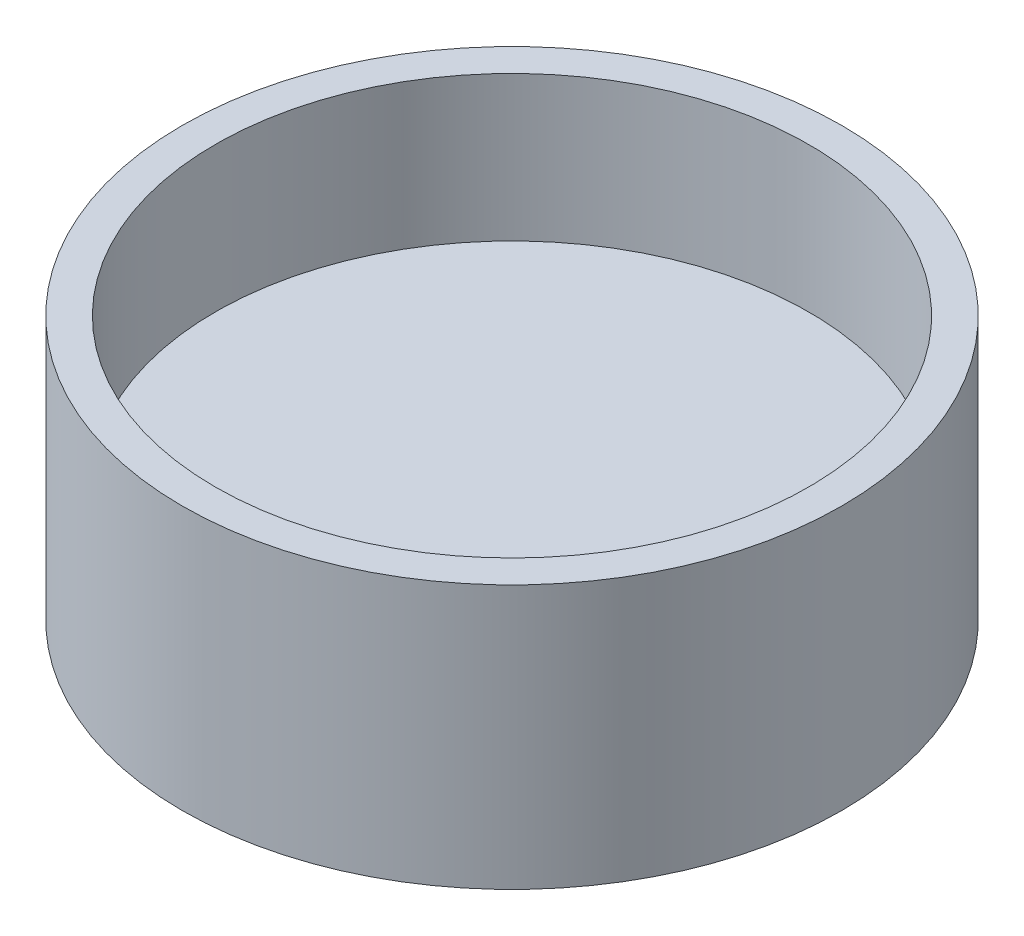
from build123d import *

# Parameters (mm, degrees)
SKETCH1_R           = 12.5
BOSS_EXTRUDE1_DEPTH = 5
SKETCH2_R           = 11.25
CUT_EXTRUDE1_DEPTH  = 5.5
CUT_EXTRUDE2_START  = -3
SKETCH3_R           = 11.25
CUT_EXTRUDE2_DEPTH  = 3


with BuildPart() as part:
    # Sketch1 → Boss-Extrude1 (new, symmetric)
    with BuildSketch(Plane(origin=(0, 0, 0), x_dir=(1, 0, 0), z_dir=(0, 1, 0))):
        with Locations(Location((0, 0, 0), (0, 0, 270))):
            Circle(SKETCH1_R)
    extrude(amount=BOSS_EXTRUDE1_DEPTH, both=True)

    # Sketch2 → Cut-Extrude1 (cut)
    with BuildSketch(Plane(origin=(0, 5, 0), x_dir=(1, 0, 0), z_dir=(0, 1, 0))):
        with Locations(Location((0, 0, 0), (0, 0, 270))):
            Circle(SKETCH2_R)
    extrude(amount=-CUT_EXTRUDE1_DEPTH, mode=Mode.SUBTRACT)

    # Sketch3 → Cut-Extrude2 (cut)
    with BuildSketch(Plane.XZ.offset(5).offset(CUT_EXTRUDE2_START)):
        with Locations(Location((0, 0, 0), (0, 0, 90))):
            Circle(SKETCH3_R)
    extrude(amount=CUT_EXTRUDE2_DEPTH, mode=Mode.SUBTRACT)


solid = part.part
